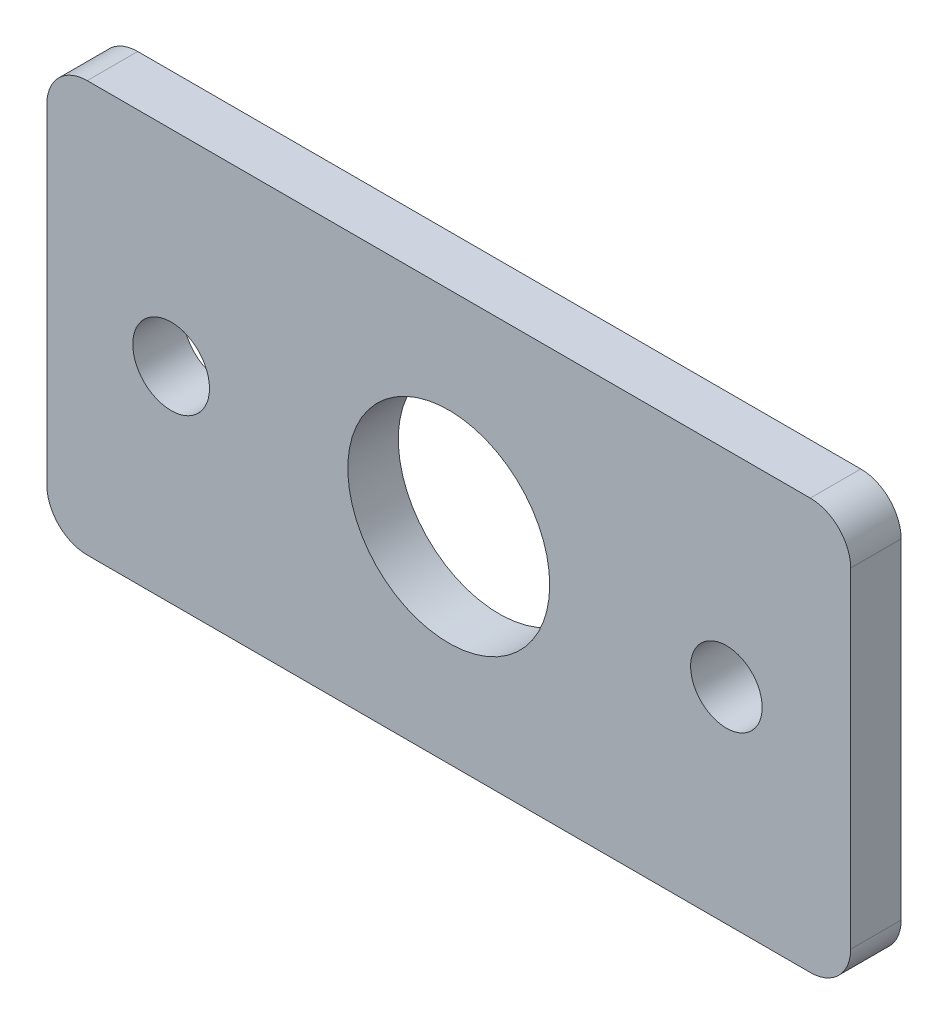
from build123d import *

# Parameters (mm, degrees)
SKETCH1_W           = 50.55571166
SKETCH1_H           = 25.842581666
SKETCH1_R           = 2.413
SKETCH1_R_2         = 2.249766629
SKETCH1_R_3         = 6.35
BOSS_EXTRUDE1_DEPTH = 3.175
FILLET1_R           = 2.54


with BuildPart() as part:
    # Sketch1 → Boss-Extrude1 (new body)
    with BuildSketch(Plane.XY):
        Rectangle(SKETCH1_W, SKETCH1_H)
        with Locations((-17.4625, 0)):
            Circle(SKETCH1_R, mode=Mode.SUBTRACT)
        with Locations((17.4625, 0)):
            Circle(SKETCH1_R_2, mode=Mode.SUBTRACT)
        Circle(SKETCH1_R_3, mode=Mode.SUBTRACT)
    extrude(amount=BOSS_EXTRUDE1_DEPTH)

    # Fillet1
    fillet1_edges = [part.edges().sort_by_distance(p)[0] for p in [
        (25.27785583, -12.921290833, 1.5875),
        (-25.27785583, -12.921290833, 1.5875),
        (-25.27785583, 12.921290833, 1.5875),
        (25.27785583, 12.921290833, 1.5875),
    ]]
    fillet(fillet1_edges, radius=FILLET1_R)


solid = part.part
